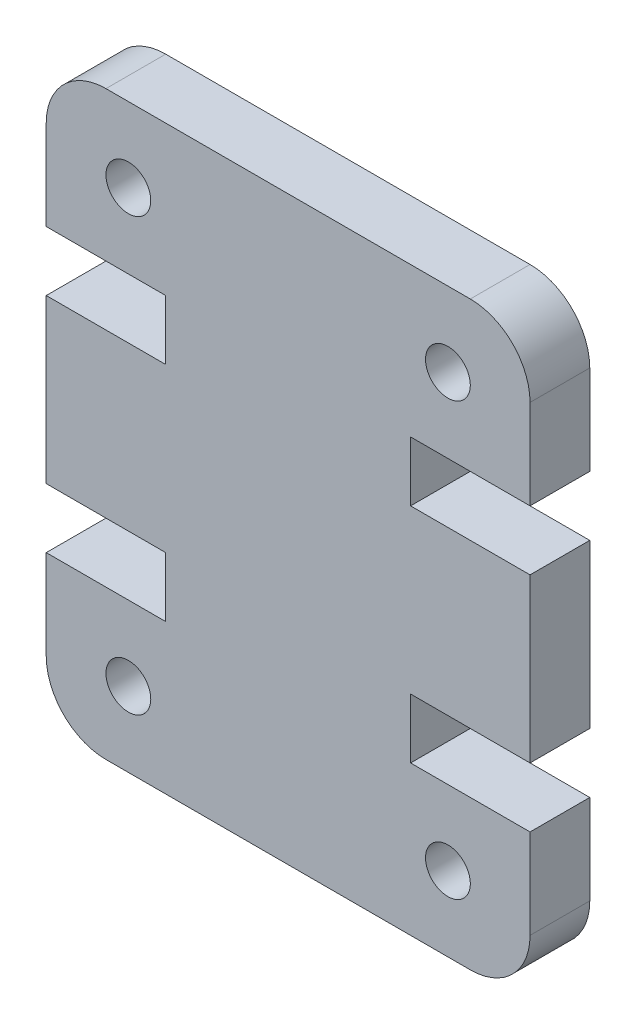
from build123d import *

# Parameters (mm, degrees)
SKETCH2_R           = 0.75
BOSS_EXTRUDE1_DEPTH = 2


with BuildPart() as part:
    # Sketch2 → Boss-Extrude1 (new body)
    with BuildSketch(Plane.XY):
        with BuildLine():
            Line((0, 7), (0, 12.455))
            Line((0, 12.455), (4, 12.455))
            Line((4, 12.455), (4, 14.455))
            Line((4, 14.455), (0, 14.455))
            Line((0, 14.455), (0, 17.455))
            ThreePointArc((0, 17.455), (0.585786438, 18.869213562), (2, 19.455))
            Line((2, 19.455), (14.2, 19.455))
            ThreePointArc((14.2, 19.455), (15.614213562, 18.869213562), (16.2, 17.455))
            Line((16.2, 17.455), (16.2, 14.455))
            Line((16.2, 14.455), (12.2, 14.455))
            Line((12.2, 14.455), (12.2, 12.455))
            Line((12.2, 12.455), (16.2, 12.455))
            Line((16.2, 12.455), (16.2, 7))
            Line((16.2, 7), (12.2, 7))
            Line((12.2, 7), (12.2, 5))
            Line((12.2, 5), (16.2, 5))
            Line((16.2, 5), (16.2, 2))
            ThreePointArc((16.2, 2), (15.614213562, 0.585786438), (14.2, 0))
            Line((14.2, 0), (2, 0))
            ThreePointArc((2, 0), (0.585786438, 0.585786438), (0, 2))
            Line((0, 2), (0, 5))
            Line((0, 5), (4, 5))
            Line((4, 5), (4, 7))
            Line((4, 7), (0, 7))
        make_face()
        with Locations(Location((13.45, 2.5, 0), (0, 0, 180))):
            Circle(SKETCH2_R, mode=Mode.SUBTRACT)
        with Locations(Location((2.75, 16.955, 0), (0, 0, 180))):
            Circle(SKETCH2_R, mode=Mode.SUBTRACT)
        with Locations((2.75, 2.5)):
            Circle(SKETCH2_R, mode=Mode.SUBTRACT)
        with Locations((13.45, 16.955)):
            Circle(SKETCH2_R, mode=Mode.SUBTRACT)
    extrude(amount=BOSS_EXTRUDE1_DEPTH)


solid = part.part
